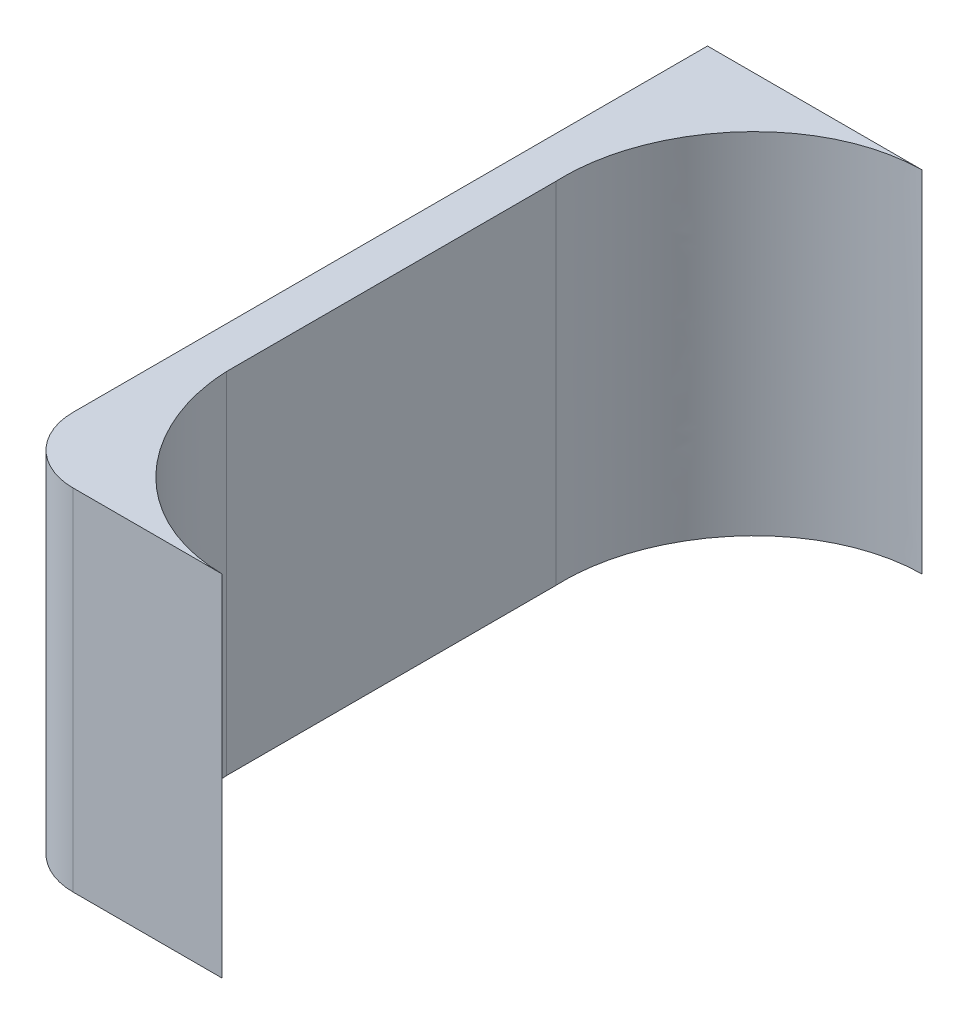
from build123d import *

# Parameters (mm, degrees)
SKETCH1_W           = 60
SKETCH1_H           = 80
BOSS_EXTRUDE1_DEPTH = 160
CUT_EXTRUDE1_DEPTH  = 182.383571472
FILLET1_R           = 15


with BuildPart() as part:
    # Sketch1 → Boss-Extrude1 (new body)
    with BuildSketch(Plane.XY):
        Rectangle(SKETCH1_W, SKETCH1_H)
    extrude(amount=BOSS_EXTRUDE1_DEPTH)

    # Sketch2 → Cut-Extrude1 (cut, through all)
    with BuildSketch(Plane(origin=(0, 40, 0), x_dir=(1, 0, 0), z_dir=(0, 1, 0))):
        with BuildLine():
            Line((-20.538426818, -44.05376626), (-20.538426818, -80))
            Line((-20.538426818, -80), (30, -80))
            Line((30, -80), (30, 0))
            Line((30, 0), (19, 0))
            add(Edge.make_bspline(
                [(19, 0), (-4.370713607, -0.406174328), (-21.495622782, -22.117426015), (-20.538426818, -44.05376626)],
                knots=[0, 0, 0, 0, 1, 1, 1, 1], degree=3))
        make_face()
        with BuildLine():
            Line((-20.538426818, -80), (-20.538426818, -115.94623374))
            Line((-20.538426818, -115.94623374), (-20.538426818, -119.465924684))
            add(Edge.make_bspline(
                [(19, -160), (-3.118929784, -159.61558121), (-19.643213017, -140.147251157), (-20.538426818, -119.465924684)],
                knots=[0, 0, 0, 0, 0.946437929, 0.946437929, 0.946437929, 0.946437929], degree=3))
            Line((19, -160), (30, -160))
            Line((30, -160), (30, -80))
            Line((30, -80), (-20.538426818, -80))
        make_face()
    extrude(amount=-CUT_EXTRUDE1_DEPTH, mode=Mode.SUBTRACT)

    # Fillet1
    fillet1_edges = [part.edges().sort_by_distance(p)[0] for p in [
        (-30, 0, 160),
    ]]
    fillet(fillet1_edges, radius=FILLET1_R)


solid = part.part
